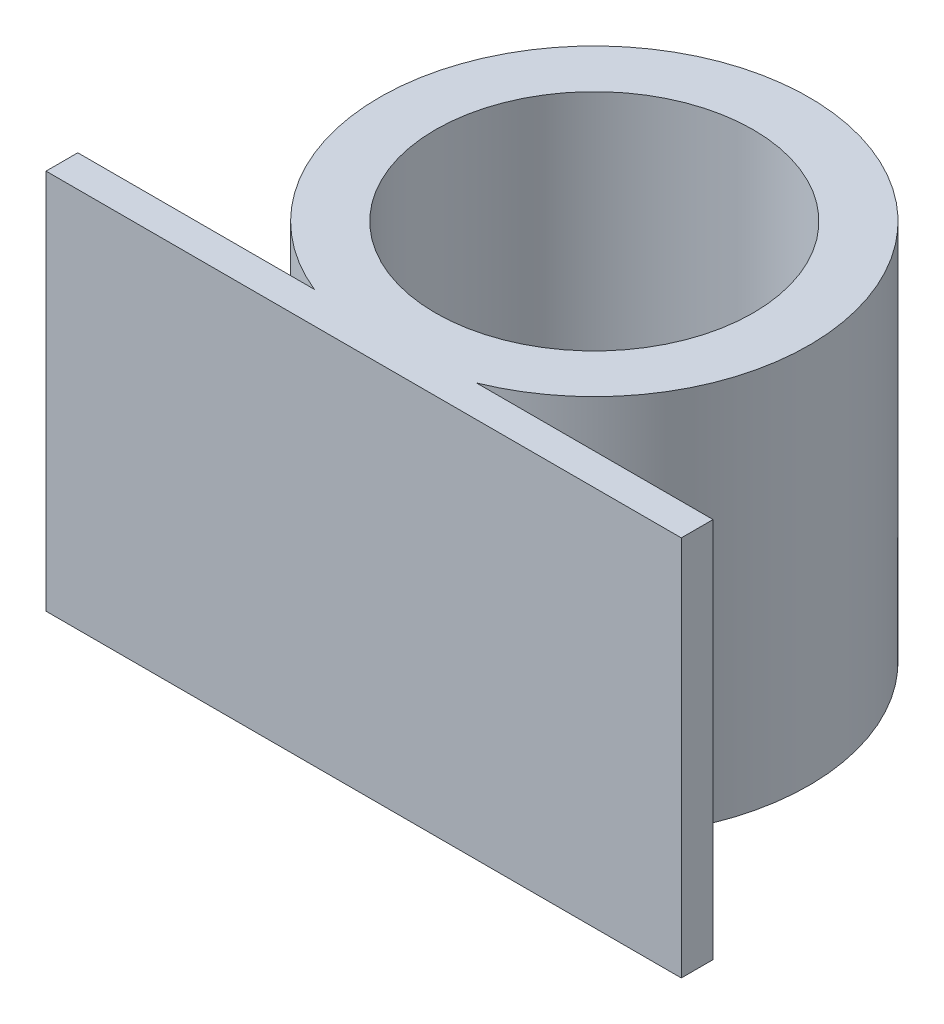
from build123d import *

# Parameters (mm, degrees)
SKETCH1_R           = 10
BOSS_EXTRUDE1_DEPTH = 20
BOSS_EXTRUDE2_START = 4
BOSS_EXTRUDE2_DEPTH = 4


with BuildPart() as part:
    # Sketch1 → Boss-Extrude1 (new body)
    with BuildSketch(Plane(origin=(0, 0, 0), x_dir=(1, 0, 0), z_dir=(0, 1, 0))):
        with BuildLine():
            Line((5.103736684, -12.52406407), (20, -12.52406407))
            Line((20, -12.52406407), (20, -14.52406407))
            Line((20, -14.52406407), (-20, -14.52406407))
            Line((-20, -14.52406407), (-20, -12.52406407))
            Line((-20, -12.52406407), (-5.103736684, -12.52406407))
            ThreePointArc((-5.103736684, -12.52406407), (0, 13.52406407), (5.103736684, -12.52406407))
        make_face()
        with Locations(Location((0, 0, 0), (0, 0, 270))):
            Circle(SKETCH1_R, mode=Mode.SUBTRACT)
    extrude(amount=BOSS_EXTRUDE1_DEPTH)

    # Sketch2 → Boss-Extrude2 (add)
    with BuildSketch(Plane.XZ.offset(BOSS_EXTRUDE2_START)):
        with BuildLine():
            Line((5.103736684, 12.52406407), (20, 12.52406407))
            Line((20, 12.52406407), (20, 14.52406407))
            Line((20, 14.52406407), (-20, 14.52406407))
            Line((-20, 14.52406407), (-20, 12.52406407))
            Line((-20, 12.52406407), (-5.103736684, 12.52406407))
            ThreePointArc((-5.103736684, 12.52406407), (0, -13.52406407), (5.103736684, 12.52406407))
        make_face()
    extrude(amount=-BOSS_EXTRUDE2_DEPTH)


solid = part.part
